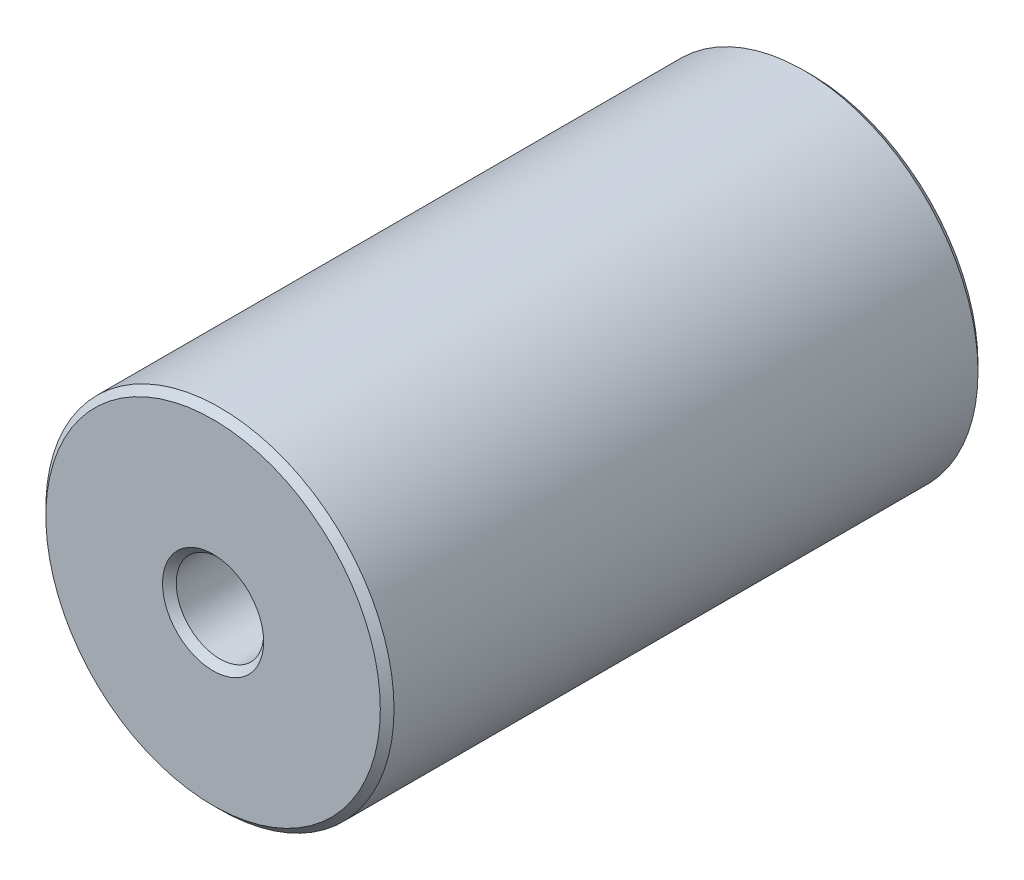
from build123d import *

# Parameters (mm, degrees)
SKETCH1_R                          = 12.7
BOSS_EXTRUDE1_DEPTH                = 43.6
SKETCH2_R                          = 3.1877
CUT_EXTRUDE1_DEPTH                 = 48.154427152
F_5_16_0_3125_DIAMETER_HOLE1_D     = 7.71652
F_5_16_0_3125_DIAMETER_HOLE1_DEPTH = 18.796
F_5_16_0_3125_DIAMETER_HOLE1_TIP   = 2.318276492
CHAMFER1_SIZE                      = 0.5
CHAMFER2_SIZE                      = 0.5


with BuildPart() as part:
    # Sketch1 → Boss-Extrude1 (new body)
    with BuildSketch(Plane.XY):
        Circle(SKETCH1_R)
    extrude(amount=BOSS_EXTRUDE1_DEPTH)

    # Sketch2 → Cut-Extrude1 (cut, through all)
    with BuildSketch(Plane.XY.offset(43.6)):
        Circle(SKETCH2_R)
    extrude(amount=-CUT_EXTRUDE1_DEPTH, mode=Mode.SUBTRACT)

    # 5/16 (0.3125) Diameter Hole1
    with Locations(Plane(origin=(0, 0, 0), x_dir=(-1, 0, 0), z_dir=(0, 0, -1))):
        with Locations((0, 0)):
            Hole(F_5_16_0_3125_DIAMETER_HOLE1_D / 2, depth=F_5_16_0_3125_DIAMETER_HOLE1_DEPTH)
            with Locations((0, 0, -(F_5_16_0_3125_DIAMETER_HOLE1_DEPTH + F_5_16_0_3125_DIAMETER_HOLE1_TIP / 2))):  # 118° drill point
                Cone(0, F_5_16_0_3125_DIAMETER_HOLE1_D / 2, F_5_16_0_3125_DIAMETER_HOLE1_TIP, mode=Mode.SUBTRACT)

    # Chamfer1
    chamfer1_edges = [part.edges().sort_by_distance(p)[0] for p in [
        (-12.7, 0, 0),
        (-12.7, 0, 43.6),
    ]]
    chamfer(chamfer1_edges, length=CHAMFER1_SIZE)

    # Chamfer2
    chamfer2_edges = [part.edges().sort_by_distance(p)[0] for p in [
        (-3.1877, 0, 43.6),
    ]]
    chamfer(chamfer2_edges, length=CHAMFER2_SIZE)


solid = part.part
